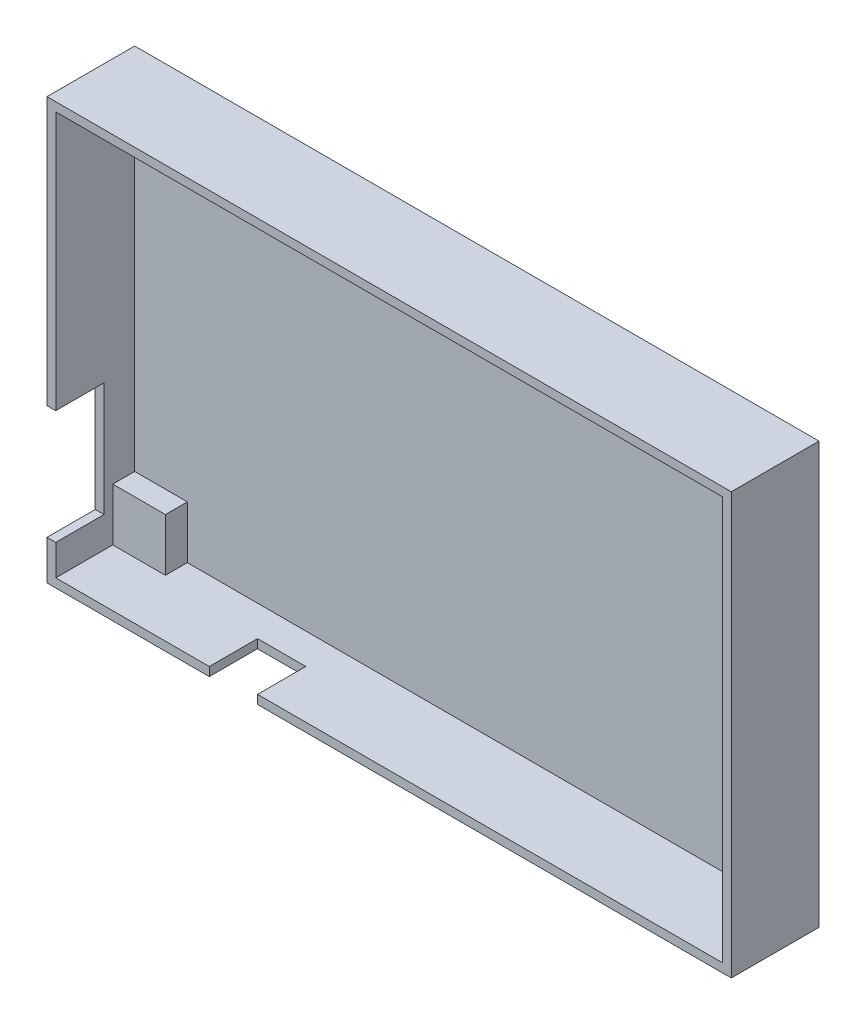
from build123d import *

# Parameters (mm, degrees)
ESQUISSE1_W             = 156
ESQUISSE1_H             = 96
BOSS_EXTRU_1_DEPTH      = 2
ESQUISSE2_W             = 156
ESQUISSE2_H             = 96
ESQUISSE2_W_2           = 152
ESQUISSE2_H_2           = 92
BOSS_EXTRU_2_DEPTH      = 18
ESQUISSE3_W             = 12
ESQUISSE3_H             = 12
BOSS_EXTRU_3_DEPTH      = 5
ESQUISSE4_W             = 12.488308145
ESQUISSE4_H             = 26
ESQUISSE4_W_2           = 11
ESQUISSE4_H_2           = 11.218310707
ENL_V_MAT_EXTRU_1_DEPTH = 100.689086297


with BuildPart() as part:
    # Esquisse1 → Boss.-Extru.1 (new body)
    with BuildSketch(Plane.XY):
        with Locations((7.861406509, -1.444239291)):
            Rectangle(ESQUISSE1_W, ESQUISSE1_H)
    extrude(amount=BOSS_EXTRU_1_DEPTH)

    # Esquisse2 → Boss.-Extru.2 (add)
    with BuildSketch(Plane.XY.offset(2)):
        with Locations((7.861406509, -1.444239291)):
            Rectangle(ESQUISSE2_W, ESQUISSE2_H)
        with Locations((7.861406509, -1.444239291)):
            Rectangle(ESQUISSE2_W_2, ESQUISSE2_H_2, mode=Mode.SUBTRACT)
    extrude(amount=BOSS_EXTRU_2_DEPTH)

    # Esquisse3 → Boss.-Extru.3 (add)
    with BuildSketch(Plane.XY.offset(2)):
        with Locations((-62.138593491, 38.555760709)):
            Rectangle(ESQUISSE3_W, ESQUISSE3_H)
        with Locations((77.861406509, -41.444239291)):
            Rectangle(ESQUISSE3_W, ESQUISSE3_H)
        with Locations((77.861406509, 38.555760709)):
            Rectangle(ESQUISSE3_W, ESQUISSE3_H)
        with Locations((-62.138593491, -41.444239291)):
            Rectangle(ESQUISSE3_W, ESQUISSE3_H)
    extrude(amount=BOSS_EXTRU_3_DEPTH)

    # Esquisse4 → Enlèv. mat.-Extru.1 (cut, through all)
    with BuildSketch(Plane.XY.offset(9)):
        with Locations((-68.655939158, -27.444239291)):
            Rectangle(ESQUISSE4_W, ESQUISSE4_H)
        with Locations((-27.638593491, -49.280809473)):
            Rectangle(ESQUISSE4_W_2, ESQUISSE4_H_2)
    extrude(amount=ENL_V_MAT_EXTRU_1_DEPTH, mode=Mode.SUBTRACT)


solid = part.part
